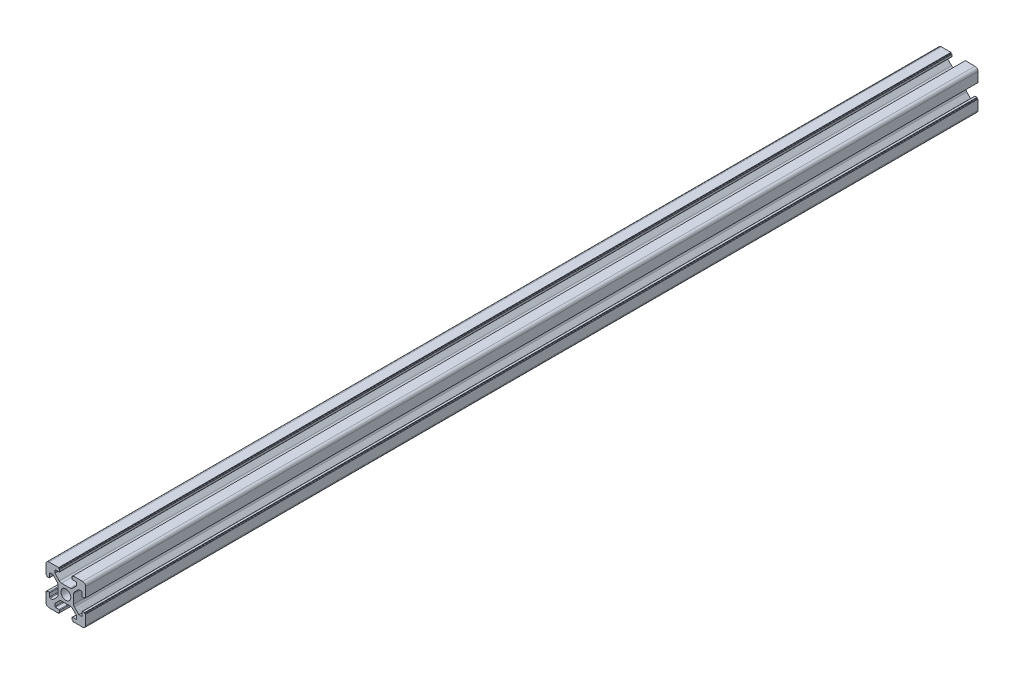
from build123d import *

# Parameters (mm, degrees)
SKETCH_1_R      = 2.5
EXTRUDE_1_DEPTH = 450


with BuildPart() as part:
    # 草图1 → 凸台-拉伸1 (new body)
    with BuildSketch(Plane.XY):
        with BuildLine():
            Line((4.215995631, 3.244230202), (6.436655803, 5.464890373))
            Line((6.436655803, 5.464890373), (7.776655803, 5.464890373))
            ThreePointArc((7.776655803, 5.464890373), (7.988787838, 5.377022408), (8.076655803, 5.164890373))
            Line((8.076655803, 5.164890373), (8.076655803, 3.364890373))
            ThreePointArc((8.076655803, 3.364890373), (8.164523769, 3.152758339), (8.376655803, 3.064890373))
            Line((8.376655803, 3.064890373), (9.376655803, 3.064890373))
            Line((9.376655803, 3.064890373), (9.376655803, 3.364890373))
            ThreePointArc((9.376655803, 3.364890373), (9.435234447, 3.50631173), (9.576655803, 3.564890373))
            Line((9.576655803, 3.564890373), (9.876655803, 3.564890373))
            Line((9.876655803, 3.564890373), (9.876655803, 8.464890373))
            ThreePointArc((9.876655803, 8.464890373), (9.437315975, 9.525550545), (8.376655803, 9.964890373))
            Line((8.376655803, 9.964890373), (3.476655803, 9.964890373))
            Line((3.476655803, 9.964890373), (3.476655803, 9.664890373))
            ThreePointArc((3.476655803, 9.664890373), (3.418077159, 9.523469017), (3.276655803, 9.464890373))
            Line((3.276655803, 9.464890373), (2.976655803, 9.464890373))
            Line((2.976655803, 9.464890373), (2.976655803, 8.464890373))
            ThreePointArc((2.976655803, 8.464890373), (3.064523769, 8.252758339), (3.276655803, 8.164890373))
            Line((3.276655803, 8.164890373), (5.076655803, 8.164890373))
            ThreePointArc((5.076655803, 8.164890373), (5.288787838, 8.077022408), (5.376655803, 7.864890373))
            Line((5.376655803, 7.864890373), (5.376655803, 6.524890373))
            Line((5.376655803, 6.524890373), (3.155995631, 4.304230202))
            ThreePointArc((3.155995631, 4.304230202), (2.669360608, 3.979071075), (2.09533546, 3.864890373))
            Line((2.09533546, 3.864890373), (-2.342023853, 3.864890373))
            ThreePointArc((-2.342023853, 3.864890373), (-2.916049002, 3.979071075), (-3.402684025, 4.304230202))
            Line((-3.402684025, 4.304230202), (-5.623344197, 6.524890373))
            Line((-5.623344197, 6.524890373), (-5.623344197, 7.864890373))
            ThreePointArc((-5.623344197, 7.864890373), (-5.535476231, 8.077022408), (-5.323344197, 8.164890373))
            Line((-5.323344197, 8.164890373), (-3.523344197, 8.164890373))
            ThreePointArc((-3.523344197, 8.164890373), (-3.311212162, 8.252758339), (-3.223344197, 8.464890373))
            Line((-3.223344197, 8.464890373), (-3.223344197, 9.464890373))
            Line((-3.223344197, 9.464890373), (-3.523344197, 9.464890373))
            ThreePointArc((-3.523344197, 9.464890373), (-3.664765553, 9.523469017), (-3.723344197, 9.664890373))
            Line((-3.723344197, 9.664890373), (-3.723344197, 9.964890373))
            Line((-3.723344197, 9.964890373), (-8.623344197, 9.964890373))
            ThreePointArc((-8.623344197, 9.964890373), (-9.684004369, 9.525550545), (-10.123344197, 8.464890373))
            Line((-10.123344197, 8.464890373), (-10.123344197, 3.564890373))
            Line((-10.123344197, 3.564890373), (-9.823344197, 3.564890373))
            ThreePointArc((-9.823344197, 3.564890373), (-9.681922841, 3.50631173), (-9.623344197, 3.364890373))
            Line((-9.623344197, 3.364890373), (-9.623344197, 3.064890373))
            Line((-9.623344197, 3.064890373), (-8.623344197, 3.064890373))
            ThreePointArc((-8.623344197, 3.064890373), (-8.411212162, 3.152758339), (-8.323344197, 3.364890373))
            Line((-8.323344197, 3.364890373), (-8.323344197, 5.164890373))
            ThreePointArc((-8.323344197, 5.164890373), (-8.235476231, 5.377022408), (-8.023344197, 5.464890373))
            Line((-8.023344197, 5.464890373), (-6.683344197, 5.464890373))
            Line((-6.683344197, 5.464890373), (-4.462684025, 3.244230202))
            ThreePointArc((-4.462684025, 3.244230202), (-4.137524898, 2.757595178), (-4.023344197, 2.18357003))
            Line((-4.023344197, 2.18357003), (-4.023344197, -2.253789283))
            ThreePointArc((-4.023344197, -2.253789283), (-4.137524898, -2.827814432), (-4.462684025, -3.314449455))
            Line((-4.462684025, -3.314449455), (-6.683344197, -5.535109627))
            Line((-6.683344197, -5.535109627), (-8.023344197, -5.535109627))
            ThreePointArc((-8.023344197, -5.535109627), (-8.235476231, -5.447241661), (-8.323344197, -5.235109627))
            Line((-8.323344197, -5.235109627), (-8.323344197, -3.435109627))
            ThreePointArc((-8.323344197, -3.435109627), (-8.411212162, -3.222977592), (-8.623344197, -3.135109627))
            Line((-8.623344197, -3.135109627), (-9.623344197, -3.135109627))
            Line((-9.623344197, -3.135109627), (-9.623344197, -3.435109627))
            ThreePointArc((-9.623344197, -3.435109627), (-9.681922841, -3.576530983), (-9.823344197, -3.635109627))
            Line((-9.823344197, -3.635109627), (-10.123344197, -3.635109627))
            Line((-10.123344197, -3.635109627), (-10.123344197, -8.535109627))
            ThreePointArc((-10.123344197, -8.535109627), (-9.684004369, -9.595769798), (-8.623344197, -10.035109627))
            Line((-8.623344197, -10.035109627), (-3.723344197, -10.035109627))
            Line((-3.723344197, -10.035109627), (-3.723344197, -9.735109627))
            ThreePointArc((-3.723344197, -9.735109627), (-3.664765553, -9.59368827), (-3.523344197, -9.535109627))
            Line((-3.523344197, -9.535109627), (-3.223344197, -9.535109627))
            Line((-3.223344197, -9.535109627), (-3.223344197, -8.535109627))
            ThreePointArc((-3.223344197, -8.535109627), (-3.311212162, -8.322977592), (-3.523344197, -8.235109627))
            Line((-3.523344197, -8.235109627), (-5.323344197, -8.235109627))
            ThreePointArc((-5.323344197, -8.235109627), (-5.535476231, -8.147241661), (-5.623344197, -7.935109627))
            Line((-5.623344197, -7.935109627), (-5.623344197, -6.595109627))
            Line((-5.623344197, -6.595109627), (-3.402684025, -4.374449455))
            ThreePointArc((-3.402684025, -4.374449455), (-2.916049002, -4.049290328), (-2.342023853, -3.935109627))
            Line((-2.342023853, -3.935109627), (2.09533546, -3.935109627))
            ThreePointArc((2.09533546, -3.935109627), (2.669360608, -4.049290328), (3.155995631, -4.374449455))
            Line((3.155995631, -4.374449455), (5.376655803, -6.595109627))
            Line((5.376655803, -6.595109627), (5.376655803, -7.935109627))
            ThreePointArc((5.376655803, -7.935109627), (5.288787838, -8.147241661), (5.076655803, -8.235109627))
            Line((5.076655803, -8.235109627), (3.276655803, -8.235109627))
            ThreePointArc((3.276655803, -8.235109627), (3.064523769, -8.322977592), (2.976655803, -8.535109627))
            Line((2.976655803, -8.535109627), (2.976655803, -9.535109627))
            Line((2.976655803, -9.535109627), (3.276655803, -9.535109627))
            ThreePointArc((3.276655803, -9.535109627), (3.418077159, -9.59368827), (3.476655803, -9.735109627))
            Line((3.476655803, -9.735109627), (3.476655803, -10.035109627))
            Line((3.476655803, -10.035109627), (8.376655803, -10.035109627))
            ThreePointArc((8.376655803, -10.035109627), (9.437315975, -9.595769798), (9.876655803, -8.535109627))
            Line((9.876655803, -8.535109627), (9.876655803, -3.635109627))
            Line((9.876655803, -3.635109627), (9.576655803, -3.635109627))
            ThreePointArc((9.576655803, -3.635109627), (9.435234447, -3.576530983), (9.376655803, -3.435109627))
            Line((9.376655803, -3.435109627), (9.376655803, -3.135109627))
            Line((9.376655803, -3.135109627), (8.376655803, -3.135109627))
            ThreePointArc((8.376655803, -3.135109627), (8.164523769, -3.222977592), (8.076655803, -3.435109627))
            Line((8.076655803, -3.435109627), (8.076655803, -5.235109627))
            ThreePointArc((8.076655803, -5.235109627), (7.988787838, -5.447241661), (7.776655803, -5.535109627))
            Line((7.776655803, -5.535109627), (6.436655803, -5.535109627))
            Line((6.436655803, -5.535109627), (4.215995631, -3.314449455))
            ThreePointArc((4.215995631, -3.314449455), (3.890836504, -2.827814432), (3.776655803, -2.253789283))
            Line((3.776655803, -2.253789283), (3.776655803, 2.18357003))
            ThreePointArc((3.776655803, 2.18357003), (3.890836504, 2.757595178), (4.215995631, 3.244230202))
        make_face()
        with Locations((-0.123344197, -0.035109627)):
            Circle(SKETCH_1_R, mode=Mode.SUBTRACT)
    extrude(amount=EXTRUDE_1_DEPTH)


solid = part.part
